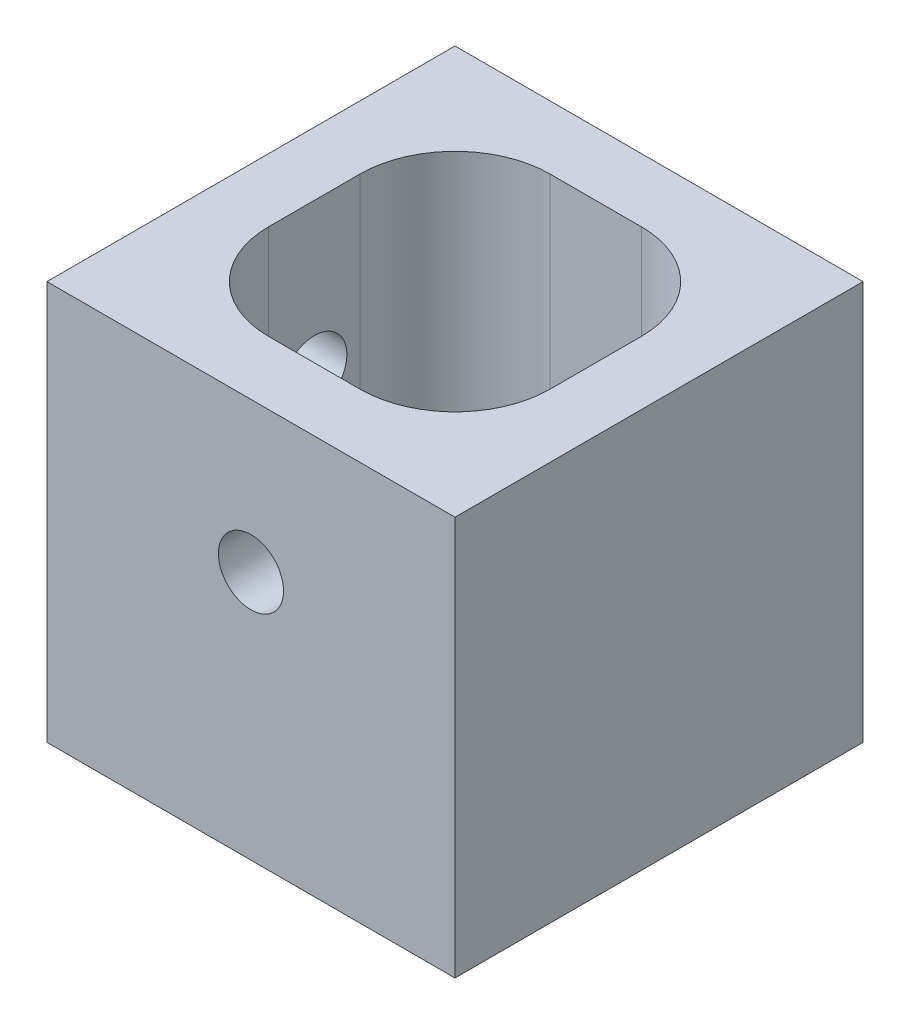
from build123d import *

# Parameters (mm, degrees)
SKETCH1_W                        = 40.9
SKETCH1_H                        = 40.9
BOSS_EXTRUDE1_DEPTH              = 40
CUT_EXTRUDE1_START               = -30.475
SKETCH3_W                        = 28.2
SKETCH3_H                        = 28.2
CUT_EXTRUDE1_DEPTH               = 30.475
FILLET1_R                        = 9.525
CIRPATTERN1_COUNT                = 2
CIRPATTERN1_ANGLE                = 90
SKETCH6_W                        = 2.5527
SKETCH6_H                        = 9.525
F_1_4_20_TAPPED_HOLE1_AT_2_COUNT = 2
F_1_4_20_TAPPED_HOLE1_AT_2_PITCH = 19.05
F_1_4_20_TAPPED_HOLE1_AT_3_COUNT = 2
F_1_4_20_TAPPED_HOLE1_AT_3_PITCH = 26.940768363
F_1_4_20_TAPPED_HOLE1_AT_4_COUNT = 2
F_1_4_20_TAPPED_HOLE1_AT_4_PITCH = 19.05


with BuildPart() as part:
    # Sketch1 → Boss-Extrude1 (new body)
    with BuildSketch(Plane(origin=(0, 0, 0), x_dir=(1, 0, 0), z_dir=(0, 1, 0))):
        Rectangle(SKETCH1_W, SKETCH1_H)
    extrude(amount=BOSS_EXTRUDE1_DEPTH)

    # Sketch3 → Cut-Extrude1 (cut)
    with BuildSketch(Plane(origin=(0, 40, 0), x_dir=(1, 0, 0), z_dir=(0, 1, 0)).offset(CUT_EXTRUDE1_START)):
        Rectangle(SKETCH3_W, SKETCH3_H)
    extrude(amount=CUT_EXTRUDE1_DEPTH, mode=Mode.SUBTRACT)

    # Fillet1
    fillet1_edges = [part.edges().sort_by_distance(p)[0] for p in [
        (14.1, 24.7625, 14.1),
        (14.1, 24.7625, -14.1),
        (-14.1, 24.7625, -14.1),
        (-14.1, 24.7625, 14.1),
    ]]
    fillet(fillet1_edges, radius=FILLET1_R)

    # Sketch4 → 5/16-18 Tapped Hole1 (revolve, cut)
    with BuildSketch(Plane(origin=(0, 25, 20.45), x_dir=(0, -1, 0), z_dir=(1, 0, 0))):
        Polygon((0, 0), (0, 24.884648974), (3.2639, 22.9235), (3.2639, 0), align=None)
    f_5_16_18_tapped_hole1 = revolve(axis=Axis((0, 25, 26.8), (0, 0, -1)), mode=Mode.SUBTRACT)

    # CirPattern1: 5/16-18 Tapped Hole1 ×2 about axis
    cirpattern1_axis = Axis((0, -2, 0), (0, -1, 0))
    for i in range(1, CIRPATTERN1_COUNT):
        add(f_5_16_18_tapped_hole1.rotate(cirpattern1_axis, i * CIRPATTERN1_ANGLE / (CIRPATTERN1_COUNT - 1)), mode=Mode.SUBTRACT)

    # Sketch6 → 1/4-20 Tapped Hole1 (revolve, cut)
    with BuildSketch(Plane(origin=(-9.525, 9.525, -9.525), x_dir=(0, 0, 1), z_dir=(1, 0, 0))):
        with Locations((1.27635, 4.7625)):
            Rectangle(SKETCH6_W, SKETCH6_H)
    f_1_4_20_tapped_hole1 = revolve(axis=Axis((-9.525, 15.875, -9.525), (0, -1, 0)), mode=Mode.SUBTRACT)

    # 1/4-20 Tapped Hole1 at 2: 1/4-20 Tapped Hole1 ×2
    with Locations(*[(i * F_1_4_20_TAPPED_HOLE1_AT_2_PITCH, 0, 0) for i in range(1, F_1_4_20_TAPPED_HOLE1_AT_2_COUNT)]):
        add(f_1_4_20_tapped_hole1, mode=Mode.SUBTRACT)

    # 1/4-20 Tapped Hole1 at 3: 1/4-20 Tapped Hole1 ×2
    with Locations(*[Vector(0.7071067811865476, 0, 0.7071067811865475) * (i * F_1_4_20_TAPPED_HOLE1_AT_3_PITCH) for i in range(1, F_1_4_20_TAPPED_HOLE1_AT_3_COUNT)]):
        add(f_1_4_20_tapped_hole1, mode=Mode.SUBTRACT)

    # 1/4-20 Tapped Hole1 at 4: 1/4-20 Tapped Hole1 ×2
    with Locations(*[(0, 0, i * F_1_4_20_TAPPED_HOLE1_AT_4_PITCH) for i in range(1, F_1_4_20_TAPPED_HOLE1_AT_4_COUNT)]):
        add(f_1_4_20_tapped_hole1, mode=Mode.SUBTRACT)


solid = part.part
